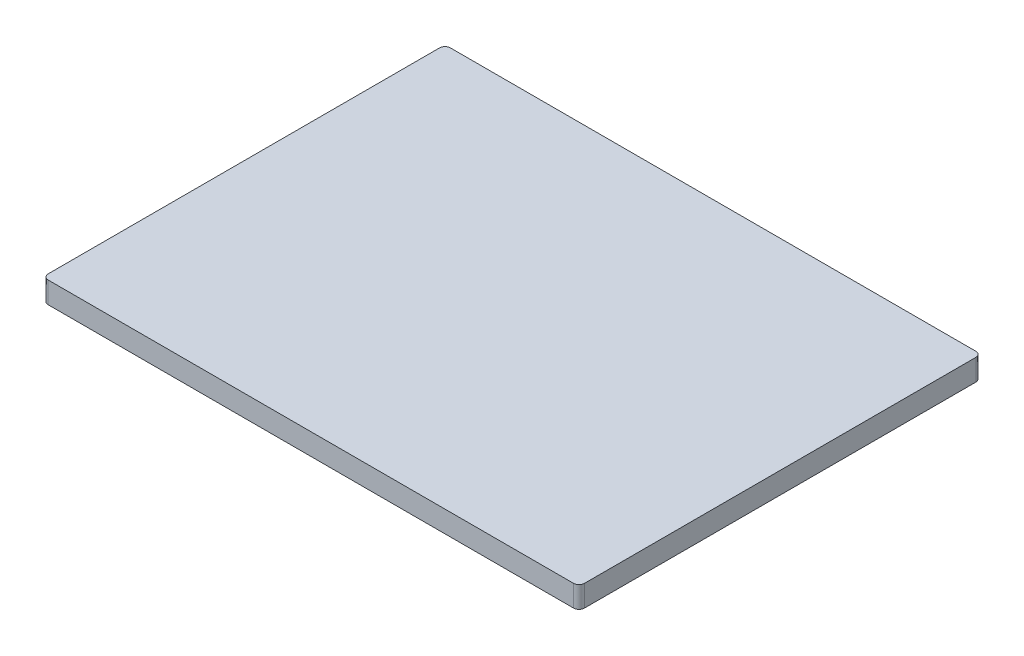
from build123d import *

# Parameters (mm, degrees)
CROQUIS1_W              = 200
CROQUIS1_H              = 150
SALIENTE_EXTRUIR1_DEPTH = 8
REDONDEO1_R             = 2


with BuildPart() as part:
    # Croquis1 → Saliente-Extruir1 (new body)
    with BuildSketch(Plane(origin=(0, 0, 0), x_dir=(1, 0, 0), z_dir=(0, 1, 0))):
        Rectangle(CROQUIS1_W, CROQUIS1_H)
    extrude(amount=SALIENTE_EXTRUIR1_DEPTH)

    # Redondeo1
    redondeo1_edges = [part.edges().sort_by_distance(p)[0] for p in [
        (100, 4, 75),
        (-100, 4, 75),
        (-100, 4, -75),
        (100, 4, -75),
    ]]
    fillet(redondeo1_edges, radius=REDONDEO1_R)


solid = part.part
